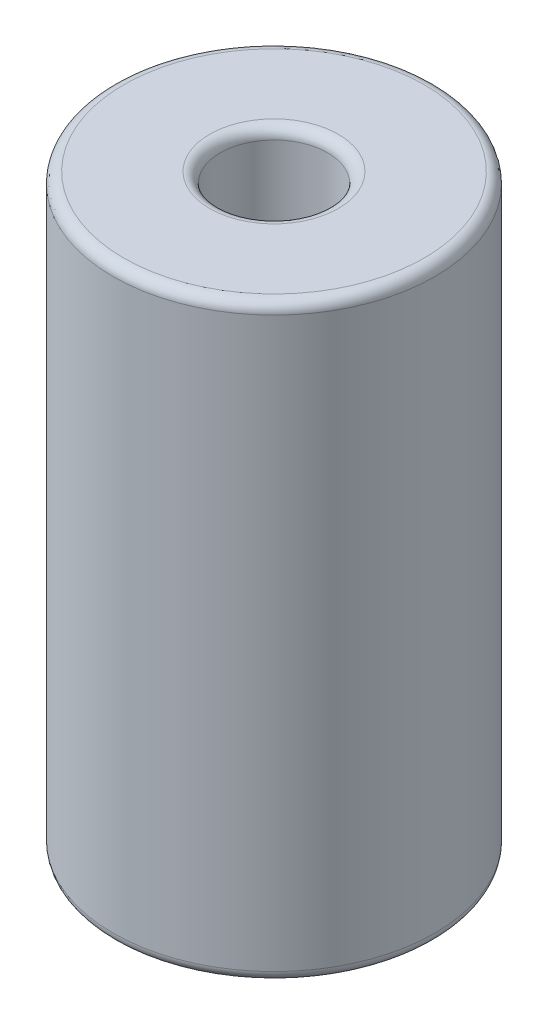
from build123d import *

# Parameters (mm, degrees)
SKETCH1_R           = 3.81
SKETCH1_R_2         = 1.27
BOSS_EXTRUDE2_DEPTH = 13.97
FILLET1_R           = 0.254


with BuildPart() as part:
    # Sketch1 → Boss-Extrude2 (new body)
    with BuildSketch(Plane(origin=(0, 0, 0), x_dir=(1, 0, 0), z_dir=(0, 1, 0))):
        with Locations(Location((0, 0, 0), (0, 0, 270))):
            Circle(SKETCH1_R)
        with Locations(Location((0, 0, 0), (0, 0, 270))):
            Circle(SKETCH1_R_2, mode=Mode.SUBTRACT)
    extrude(amount=BOSS_EXTRUDE2_DEPTH)

    # Fillet1
    fillet1_edges = [part.edges().sort_by_distance(p)[0] for p in [
        (0, 0, -3.81),
        (0, 13.97, -3.81),
        (0, 0, -1.27),
        (0, 13.97, -1.27),
    ]]
    fillet(fillet1_edges, radius=FILLET1_R)


solid = part.part
